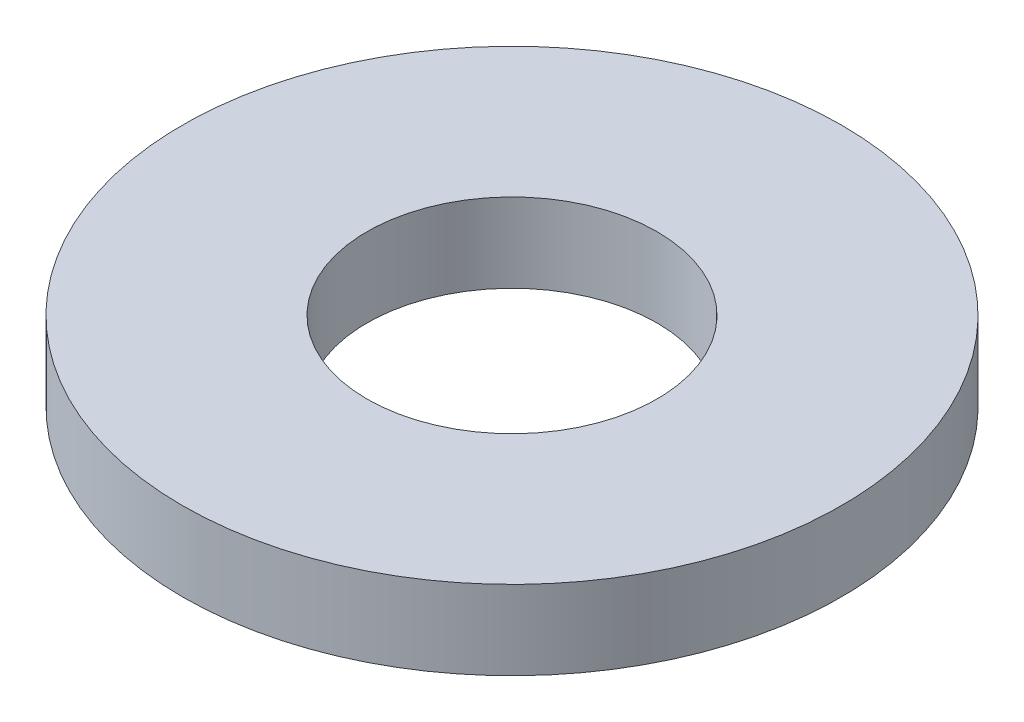
from build123d import *

# Parameters (mm, degrees)
SKICA1_R        = 1.25
SKICA1_R_2      = 0.55
VYSUNOUT1_DEPTH = 0.3


with BuildPart() as part:
    # Skica1 → Vysunout1 (new body)
    with BuildSketch(Plane(origin=(0, 0, 0), x_dir=(1, 0, 0), z_dir=(0, 1, 0))):
        with Locations(Location((0, 0, 0), (0, 0, 270))):
            Circle(SKICA1_R)
        with Locations(Location((0, 0, 0), (0, 0, 270))):
            Circle(SKICA1_R_2, mode=Mode.SUBTRACT)
    extrude(amount=VYSUNOUT1_DEPTH)


solid = part.part
